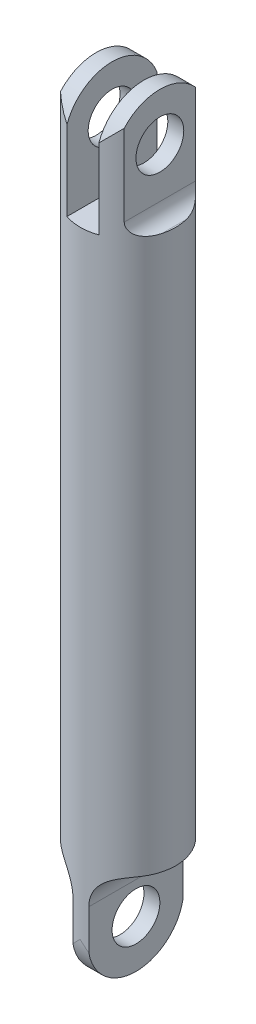
from build123d import *

# Parameters (mm, degrees)
SKETCH1_R               = 30
BOSS_EXTRUDE1_DEPTH     = 243.5
CUT_EXTRUDE1_DEPTH      = 70
FILLET1_R               = 9
FILLET2_R               = 9
SKETCH4_R               = 15
CUT_EXTRUDE2_DEPTH      = 70
CUT_EXTRUDE3_DEPTH      = 70
CUT_EXTRUDE3_DEPTH_BACK = 70
CUT_EXTRUDE4_START      = -70
CUT_EXTRUDE4_DEPTH      = 70
SKETCH8_R               = 15
CUT_EXTRUDE5_DEPTH      = 60
CUT_EXTRUDE8_DEPTH      = 60
CUT_EXTRUDE8_DEPTH_BACK = 60
FILLET3_R               = 20
FILLET4_R               = 20


with BuildPart() as part:
    # Sketch1 → Boss-Extrude1 (new, symmetric)
    with BuildSketch(Plane(origin=(0, 0, 0), x_dir=(1, 0, 0), z_dir=(0, 1, 0))):
        with Locations(Location((0, 0, 0), (0, 0, 270))):
            Circle(SKETCH1_R)
    extrude(amount=BOSS_EXTRUDE1_DEPTH, both=True)

    # Sketch3 → Cut-Extrude1 (cut)
    with BuildSketch(Plane(origin=(0, 243.5, 0), x_dir=(1, 0, 0), z_dir=(0, 1, 0))):
        with BuildLine():
            Line((-10, 28.284271247), (-10, -28.284271247))
            ThreePointArc((-10, -28.284271247), (0, -30), (10, -28.284271247))
            Line((10, -28.284271247), (10, 28.284271247))
            ThreePointArc((10, 28.284271247), (0, 30), (-10, 28.284271247))
        make_face()
        with BuildLine():
            Line((-20, 22.360679775), (-20, -22.360679775))
            ThreePointArc((-20, -22.360679775), (-30, 0), (-20, 22.360679775))
        make_face()
        with BuildLine():
            Line((20, 22.360679775), (20, -22.360679775))
            ThreePointArc((20, -22.360679775), (30, 0), (20, 22.360679775))
        make_face()
    extrude(amount=-CUT_EXTRUDE1_DEPTH, mode=Mode.SUBTRACT)

    # Fillet1
    fillet1_edges = [part.edges().sort_by_distance(p)[0] for p in [
        (-20, 173.5, 0),
    ]]
    fillet(fillet1_edges, radius=FILLET1_R)

    # Fillet2
    fillet2_edges = [part.edges().sort_by_distance(p)[0] for p in [
        (20, 173.5, 0),
    ]]
    fillet(fillet2_edges, radius=FILLET2_R)

    # Sketch4 → Cut-Extrude2 (cut)
    with BuildSketch(Plane(origin=(20, 0, 0), x_dir=(0, 0, -1), z_dir=(1, 0, 0))):
        with Locations((0, 213.5)):
            Circle(SKETCH4_R)
    extrude(amount=-CUT_EXTRUDE2_DEPTH, mode=Mode.SUBTRACT)

    # Sketch6 → Cut-Extrude3 (cut, two sides: drawn at the far end of the back side and taken through both)
    with BuildSketch(Plane(origin=(0, 0, 0), x_dir=(0, 0, -1), z_dir=(1, 0, 0)).offset(-CUT_EXTRUDE3_DEPTH_BACK)):
        with BuildLine():
            Line((-1.96e-07, 243.5), (-28.284271247, 243.5))
            Line((-28.284271247, 243.5), (-28.284271247, 223.5))
            ThreePointArc((-28.284271247, 223.5), (-17.320508156, 237.994897371), (-1.96e-07, 243.5))
        make_face()
        with BuildLine():
            Line((28.284271247, 243.5), (-1.96e-07, 243.5))
            ThreePointArc((-1.96e-07, 243.5), (17.320507996, 237.994897484), (28.284271247, 223.5))
            Line((28.284271247, 223.5), (28.284271247, 243.5))
        make_face()
    extrude(amount=CUT_EXTRUDE3_DEPTH + CUT_EXTRUDE3_DEPTH_BACK, mode=Mode.SUBTRACT)

    # Sketch7 → Cut-Extrude4 (cut)
    with BuildSketch(Plane.XZ.offset(243.5).offset(CUT_EXTRUDE4_START)):
        with BuildLine():
            Line((-5, 29.580398915), (-5, -29.580398915))
            ThreePointArc((-5, -29.580398915), (-30, 0), (-5, 29.580398915))
        make_face()
        with BuildLine():
            Line((5, 29.580398915), (5, -29.580398915))
            ThreePointArc((5, -29.580398915), (30, 0), (5, 29.580398915))
        make_face()
    extrude(amount=CUT_EXTRUDE4_DEPTH, mode=Mode.SUBTRACT)

    # Sketch8 → Cut-Extrude5 (cut)
    with BuildSketch(Plane(origin=(5, 0, 0), x_dir=(0, 0, -1), z_dir=(1, 0, 0))):
        with Locations((0, -213.5)):
            Circle(SKETCH8_R)
    extrude(amount=-CUT_EXTRUDE5_DEPTH, mode=Mode.SUBTRACT)

    # Sketch10 → Cut-Extrude8 (cut, two sides: drawn at the far end of the back side and taken through both)
    with BuildSketch(Plane(origin=(0, 0, 0), x_dir=(0, 0, -1), z_dir=(1, 0, 0)).offset(-CUT_EXTRUDE8_DEPTH_BACK)):
        with BuildLine():
            Line((30, -243.5), (30, -213.5))
            ThreePointArc((30, -213.5), (21.213203436, -234.713203436), (0, -243.5))
            Line((0, -243.5), (30, -243.5))
        make_face()
        with BuildLine():
            ThreePointArc((0, -243.5), (-21.213203436, -234.713203436), (-30, -213.5))
            Line((-30, -213.5), (-30, -243.5))
            Line((-30, -243.5), (0, -243.5))
        make_face()
    extrude(amount=CUT_EXTRUDE8_DEPTH + CUT_EXTRUDE8_DEPTH_BACK, mode=Mode.SUBTRACT)

    # Fillet3
    fillet3_edges = [part.edges().sort_by_distance(p)[0] for p in [
        (5, -173.5, 0),
    ]]
    fillet(fillet3_edges, radius=FILLET3_R)

    # Fillet4
    fillet4_edges = [part.edges().sort_by_distance(p)[0] for p in [
        (-5, -173.5, 0),
    ]]
    fillet(fillet4_edges, radius=FILLET4_R)


solid = part.part
